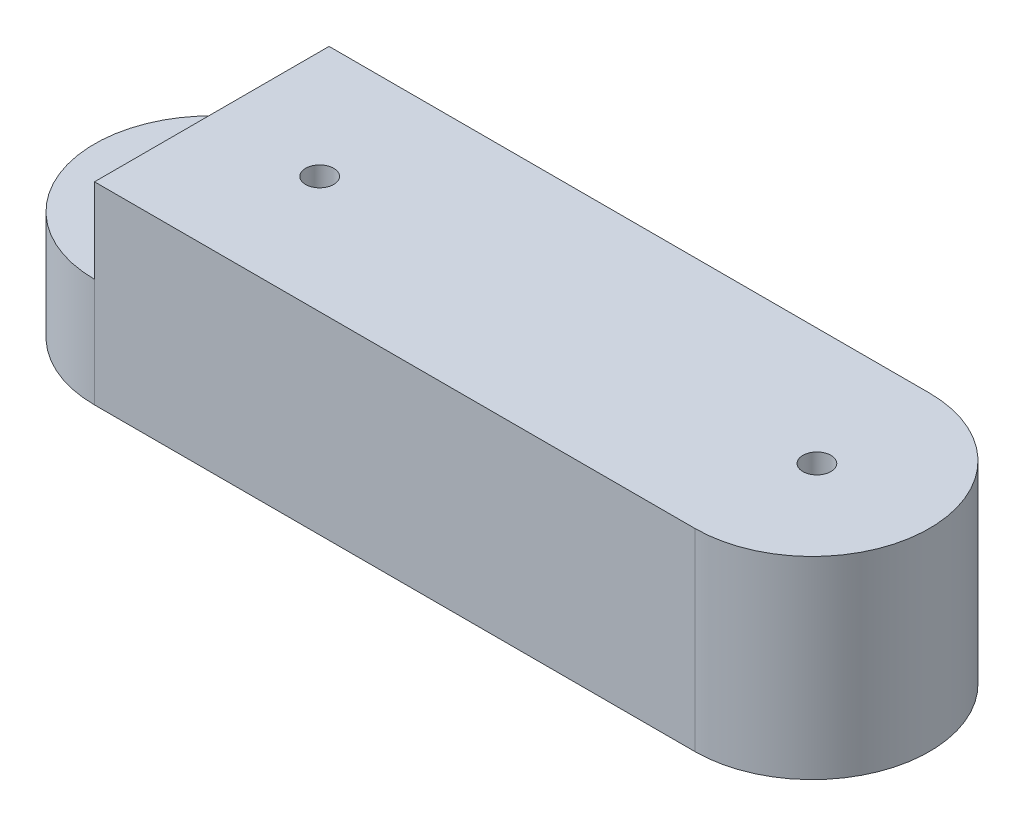
from build123d import *

# Parameters (mm, degrees)
BOSS_EXTRUDE1_DEPTH = 20.6
CUT_EXTRUDE1_START  = -9
CUT_EXTRUDE1_DEPTH  = 9
SKETCH4_R           = 1.5
CUT_EXTRUDE2_DEPTH  = 4


with BuildPart() as part:
    # Sketch1 → Boss-Extrude1 (new body)
    with BuildSketch(Plane(origin=(0, 0, 0), x_dir=(1, 0, 0), z_dir=(0, 1, 0))):
        with BuildLine():
            ThreePointArc((0, 25), (-12.5, 12.5), (0, 0))
            Line((0, 0), (0, 25))
        make_face()
        with BuildLine():
            Line((0, 25), (0, 0))
            ThreePointArc((0, 0), (8.838834765, 3.661165235), (12.5, 12.5))
            ThreePointArc((12.5, 12.5), (8.838834765, 21.338834765), (0, 25))
        make_face()
        with BuildLine():
            ThreePointArc((12.5, 12.5), (8.838834765, 3.661165235), (0, 0))
            Line((0, 0), (64, 0))
            ThreePointArc((64, 0), (51.5, 12.5), (64, 25))
            Line((64, 25), (0, 25))
            ThreePointArc((0, 25), (8.838834765, 21.338834765), (12.5, 12.5))
        make_face()
        with BuildLine():
            ThreePointArc((64, 25), (51.5, 12.5), (64, 0))
            Line((64, 0), (64, 25))
        make_face()
        with BuildLine():
            Line((64, 25), (64, 0))
            ThreePointArc((64, 0), (72.838834765, 3.661165235), (76.5, 12.5))
            ThreePointArc((76.5, 12.5), (72.838834765, 21.338834765), (64, 25))
        make_face()
    extrude(amount=BOSS_EXTRUDE1_DEPTH)

    # Sketch3 → Cut-Extrude1 (cut)
    with BuildSketch(Plane(origin=(0, 20.6, 0), x_dir=(1, 0, 0), z_dir=(0, 1, 0)).offset(CUT_EXTRUDE1_START)):
        with BuildLine():
            Line((0, 0), (0, 25))
            ThreePointArc((0, 25), (-12.5, 12.5), (0, 0))
        make_face()
    extrude(amount=CUT_EXTRUDE1_DEPTH, mode=Mode.SUBTRACT)

    # Sketch4 → Cut-Extrude2 (cut)
    with BuildSketch(Plane(origin=(0, 20.6, 0), x_dir=(1, 0, 0), z_dir=(0, 1, 0))):
        with Locations(Location((64.5, 12.5, 0), (0, 0, 270))):
            Circle(SKETCH4_R)
        with Locations(Location((11.5, 12.5, 0), (0, 0, 270))):
            Circle(SKETCH4_R)
    extrude(amount=-CUT_EXTRUDE2_DEPTH, mode=Mode.SUBTRACT)


solid = part.part
